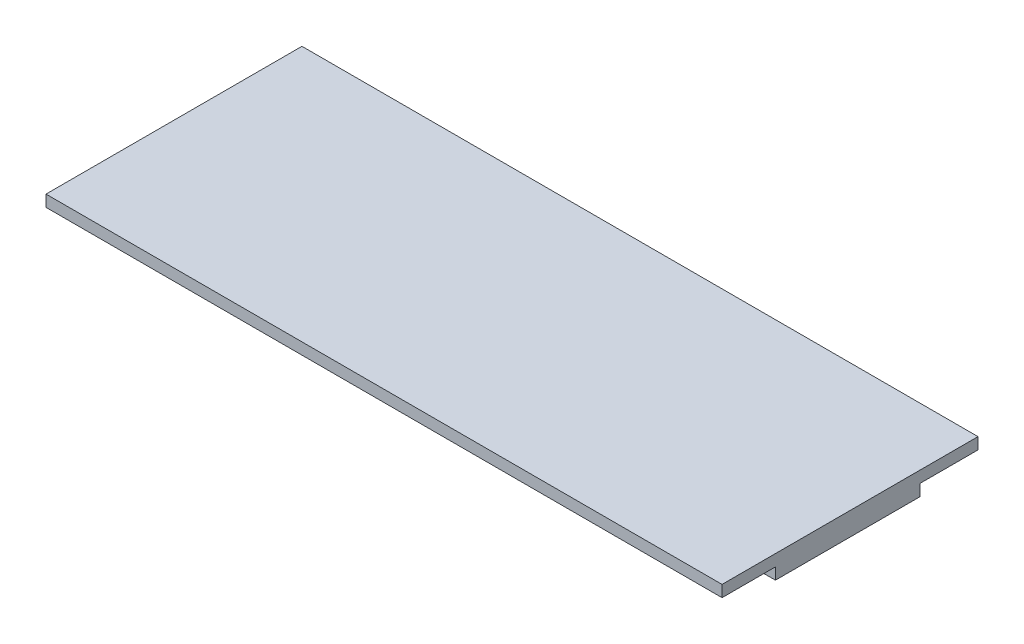
from build123d import *

# Parameters (mm, degrees)
SKETCH2_W           = 64.5
SKETCH2_H           = 24.42
BOSS_EXTRUDE1_DEPTH = 1.1
SKETCH4_W           = 64.5
SKETCH4_H           = 13.8
BOSS_EXTRUDE2_DEPTH = 1.1
SKETCH3_W           = 0.51
SKETCH3_H           = 0.5
CUT_EXTRUDE1_DEPTH  = 0.1


with BuildPart() as part:
    # Sketch2 → Boss-Extrude1 (new body)
    with BuildSketch(Plane(origin=(0, 0, 0), x_dir=(1, 0, 0), z_dir=(0, 1, 0))):
        with Locations((0, 0.21865015)):
            Rectangle(SKETCH2_W, SKETCH2_H)
    extrude(amount=BOSS_EXTRUDE1_DEPTH)

    # Sketch4 → Boss-Extrude2 (add)
    with BuildSketch(Plane.XZ):
        Rectangle(SKETCH4_W, SKETCH4_H)
    extrude(amount=BOSS_EXTRUDE2_DEPTH)

    # Sketch3 → Cut-Extrude1 (cut)
    with BuildSketch(Plane.XZ):
        with Locations((-28.063327861, 3.897575611)):
            Rectangle(SKETCH3_W, SKETCH3_H)
        with Locations((-28.063327861, 3.347575611)):
            Rectangle(SKETCH3_W, SKETCH3_H)
        with Locations((-28.063327861, 2.797575611)):
            Rectangle(SKETCH3_W, SKETCH3_H)
        with Locations((-28.673327861, 3.897575611)):
            Rectangle(SKETCH3_W, SKETCH3_H)
        with Locations((-28.063327861, 2.247575611)):
            Rectangle(SKETCH3_W, SKETCH3_H)
        with Locations((-28.063327861, 1.697575611)):
            Rectangle(SKETCH3_W, SKETCH3_H)
        with Locations((-28.063327861, 1.147575611)):
            Rectangle(SKETCH3_W, SKETCH3_H)
        with Locations((-28.673327861, 0.597575611)):
            Rectangle(SKETCH3_W, SKETCH3_H)
        with Locations((-28.063327861, 0.597575611)):
            Rectangle(SKETCH3_W, SKETCH3_H)
        with Locations((-27.453327861, 0.597575611)):
            Rectangle(SKETCH3_W, SKETCH3_H)
        with Locations((-25.633327861, 3.347575611)):
            Rectangle(SKETCH3_W, SKETCH3_H)
        with Locations((-25.023327861, 3.897575611)):
            Rectangle(SKETCH3_W, SKETCH3_H)
        with Locations((-23.803327861, 3.897575611)):
            Rectangle(SKETCH3_W, SKETCH3_H)
        with Locations((-23.193327861, 3.347575611)):
            Rectangle(SKETCH3_W, SKETCH3_H)
        with Locations((-23.193327861, 2.797575611)):
            Rectangle(SKETCH3_W, SKETCH3_H)
        with Locations((-23.803327861, 2.247575611)):
            Rectangle(SKETCH3_W, SKETCH3_H)
        with Locations((-24.413327861, 1.697575611)):
            Rectangle(SKETCH3_W, SKETCH3_H)
        with Locations((-25.023327861, 1.147575611)):
            Rectangle(SKETCH3_W, SKETCH3_H)
        with Locations((-25.023327861, 0.597575611)):
            Rectangle(SKETCH3_W, SKETCH3_H)
        with Locations((-24.413327861, 0.597575611)):
            Rectangle(SKETCH3_W, SKETCH3_H)
        with Locations((-23.803327861, 0.597575611)):
            Rectangle(SKETCH3_W, SKETCH3_H)
        with Locations((-23.193327861, 0.597575611)):
            Rectangle(SKETCH3_W, SKETCH3_H)
        with Locations((21.816672139, 2.247575611)):
            Rectangle(SKETCH3_W, SKETCH3_H)
        with Locations((22.426672139, 1.697575611)):
            Rectangle(SKETCH3_W, SKETCH3_H)
        with Locations((23.036672139, 1.147575611)):
            Rectangle(SKETCH3_W, SKETCH3_H)
        with Locations((23.646672139, 0.597575611)):
            Rectangle(SKETCH3_W, SKETCH3_H)
        with Locations((23.036672139, 0.597575611)):
            Rectangle(SKETCH3_W, SKETCH3_H)
        with Locations((22.426672139, 0.597575611)):
            Rectangle(SKETCH3_W, SKETCH3_H)
        with Locations((21.816672139, 0.597575611)):
            Rectangle(SKETCH3_W, SKETCH3_H)
        with Locations((18.166672139, 3.347575611)):
            Rectangle(SKETCH3_W, SKETCH3_H)
        with Locations((18.166672139, 2.797575611)):
            Rectangle(SKETCH3_W, SKETCH3_H)
        with Locations((18.776672139, 2.247575611)):
            Rectangle(SKETCH3_W, SKETCH3_H)
        with Locations((19.386672139, 2.247575611)):
            Rectangle(SKETCH3_W, SKETCH3_H)
        with Locations((18.166672139, 1.697575611)):
            Rectangle(SKETCH3_W, SKETCH3_H)
        with Locations((18.166672139, 1.147575611)):
            Rectangle(SKETCH3_W, SKETCH3_H)
        with Locations((18.776672139, 0.597575611)):
            Rectangle(SKETCH3_W, SKETCH3_H)
        with Locations((19.386672139, 0.597575611)):
            Rectangle(SKETCH3_W, SKETCH3_H)
        with Locations((19.996672139, 1.147575611)):
            Rectangle(SKETCH3_W, SKETCH3_H)
        with Locations((19.386672139, 3.897575611)):
            Rectangle(SKETCH3_W, SKETCH3_H)
        with Locations((19.996672139, 3.347575611)):
            Rectangle(SKETCH3_W, SKETCH3_H)
        with Locations((27.906672139, -0.702424389)):
            Rectangle(SKETCH3_W, SKETCH3_H)
        with Locations((27.906672139, -4.552424389)):
            Rectangle(SKETCH3_W, SKETCH3_H)
        with Locations((27.296672139, -4.552424389)):
            Rectangle(SKETCH3_W, SKETCH3_H)
        with Locations((26.686672139, -4.552424389)):
            Rectangle(SKETCH3_W, SKETCH3_H)
        with Locations((26.076672139, -4.552424389)):
            Rectangle(SKETCH3_W, SKETCH3_H)
        with Locations((25.466672139, -4.552424389)):
            Rectangle(SKETCH3_W, SKETCH3_H)
        with Locations((27.906672139, -1.252424389)):
            Rectangle(SKETCH3_W, SKETCH3_H)
        with Locations((27.906672139, -1.802424389)):
            Rectangle(SKETCH3_W, SKETCH3_H)
        with Locations((27.906672139, -3.452424389)):
            Rectangle(SKETCH3_W, SKETCH3_H)
        with Locations((27.906672139, -2.352424389)):
            Rectangle(SKETCH3_W, SKETCH3_H)
        with Locations((27.906672139, -4.002424389)):
            Rectangle(SKETCH3_W, SKETCH3_H)
        with Locations((-29.283327861, -0.702424389)):
            Rectangle(SKETCH3_W, SKETCH3_H)
        with Locations((-29.283327861, -1.802424389)):
            Rectangle(SKETCH3_W, SKETCH3_H)
        with Locations((-29.283327861, -2.902424389)):
            Rectangle(SKETCH3_W, SKETCH3_H)
        with Locations((-29.283327861, -4.002424389)):
            Rectangle(SKETCH3_W, SKETCH3_H)
        with Locations((-28.673327861, -4.552424389)):
            Rectangle(SKETCH3_W, SKETCH3_H)
        with Locations((-27.453327861, -4.552424389)):
            Rectangle(SKETCH3_W, SKETCH3_H)
        with Locations((-29.283327861, -1.252424389)):
            Rectangle(SKETCH3_W, SKETCH3_H)
        with Locations((-26.843327861, -4.552424389)):
            Rectangle(SKETCH3_W, SKETCH3_H)
        with Locations((-29.283327861, -4.552424389)):
            Rectangle(SKETCH3_W, SKETCH3_H)
        with Locations((-29.283327861, -3.452424389)):
            Rectangle(SKETCH3_W, SKETCH3_H)
        with Locations((-29.283327861, -2.352424389)):
            Rectangle(SKETCH3_W, SKETCH3_H)
        with Locations((-28.063327861, -4.552424389)):
            Rectangle(SKETCH3_W, SKETCH3_H)
        with Locations((-1.293327861, 1.147575611)):
            Rectangle(SKETCH3_W, SKETCH3_H)
        with Locations((-1.293327861, -1.252424389)):
            Rectangle(SKETCH3_W, SKETCH3_H)
        with Locations((-0.083327861, -1.252424389)):
            Rectangle(SKETCH3_W, SKETCH3_H)
        with Locations((0.526672139, -0.702424389)):
            Rectangle(SKETCH3_W, SKETCH3_H)
        with Locations((-1.903327861, -0.702424389)):
            Rectangle(SKETCH3_W, SKETCH3_H)
        with Locations((-1.903327861, 0.597575611)):
            Rectangle(SKETCH3_W, SKETCH3_H)
        with Locations((0.526672139, 0.597575611)):
            Rectangle(SKETCH3_W, SKETCH3_H)
        with Locations((-0.083327861, 1.697575611)):
            Rectangle(SKETCH3_W, SKETCH3_H)
        with Locations((-1.293327861, 1.697575611)):
            Rectangle(SKETCH3_W, SKETCH3_H)
        with Locations((-2.513327861, -0.702424389)):
            Rectangle(SKETCH3_W, SKETCH3_H)
        with Locations((1.136672139, -0.702424389)):
            Rectangle(SKETCH3_W, SKETCH3_H)
        with Locations((26.686672139, 4.447575611)):
            Rectangle(SKETCH3_W, SKETCH3_H)
        with Locations((26.686672139, 3.897575611)):
            Rectangle(SKETCH3_W, SKETCH3_H)
        with Locations((26.686672139, 3.347575611)):
            Rectangle(SKETCH3_W, SKETCH3_H)
        with Locations((26.686672139, 2.797575611)):
            Rectangle(SKETCH3_W, SKETCH3_H)
        with Locations((26.686672139, 2.247575611)):
            Rectangle(SKETCH3_W, SKETCH3_H)
        with Locations((26.686672139, 1.697575611)):
            Rectangle(SKETCH3_W, SKETCH3_H)
        with Locations((26.686672139, 1.147575611)):
            Rectangle(SKETCH3_W, SKETCH3_H)
        with Locations((27.296672139, 3.897575611)):
            Rectangle(SKETCH3_W, SKETCH3_H)
        with Locations((27.296672139, 0.597575611)):
            Rectangle(SKETCH3_W, SKETCH3_H)
        with Locations((26.076672139, 0.597575611)):
            Rectangle(SKETCH3_W, SKETCH3_H)
        with Locations((26.686672139, 0.597575611)):
            Rectangle(SKETCH3_W, SKETCH3_H)
        with Locations((24.256672139, 3.347575611)):
            Rectangle(SKETCH3_W, SKETCH3_H)
        with Locations((23.646672139, 3.897575611)):
            Rectangle(SKETCH3_W, SKETCH3_H)
        with Locations((23.036672139, 3.897575611)):
            Rectangle(SKETCH3_W, SKETCH3_H)
        with Locations((22.426672139, 3.347575611)):
            Rectangle(SKETCH3_W, SKETCH3_H)
        with Locations((21.816672139, 2.797575611)):
            Rectangle(SKETCH3_W, SKETCH3_H)
        with Locations((18.776672139, 3.897575611)):
            Rectangle(SKETCH3_W, SKETCH3_H)
        with Locations((27.906672139, -2.902424389)):
            Rectangle(SKETCH3_W, SKETCH3_H)
        with Locations((-0.083327861, 1.147575611)):
            Rectangle(SKETCH3_W, SKETCH3_H)
    extrude(amount=-CUT_EXTRUDE1_DEPTH, mode=Mode.SUBTRACT)


solid = part.part
